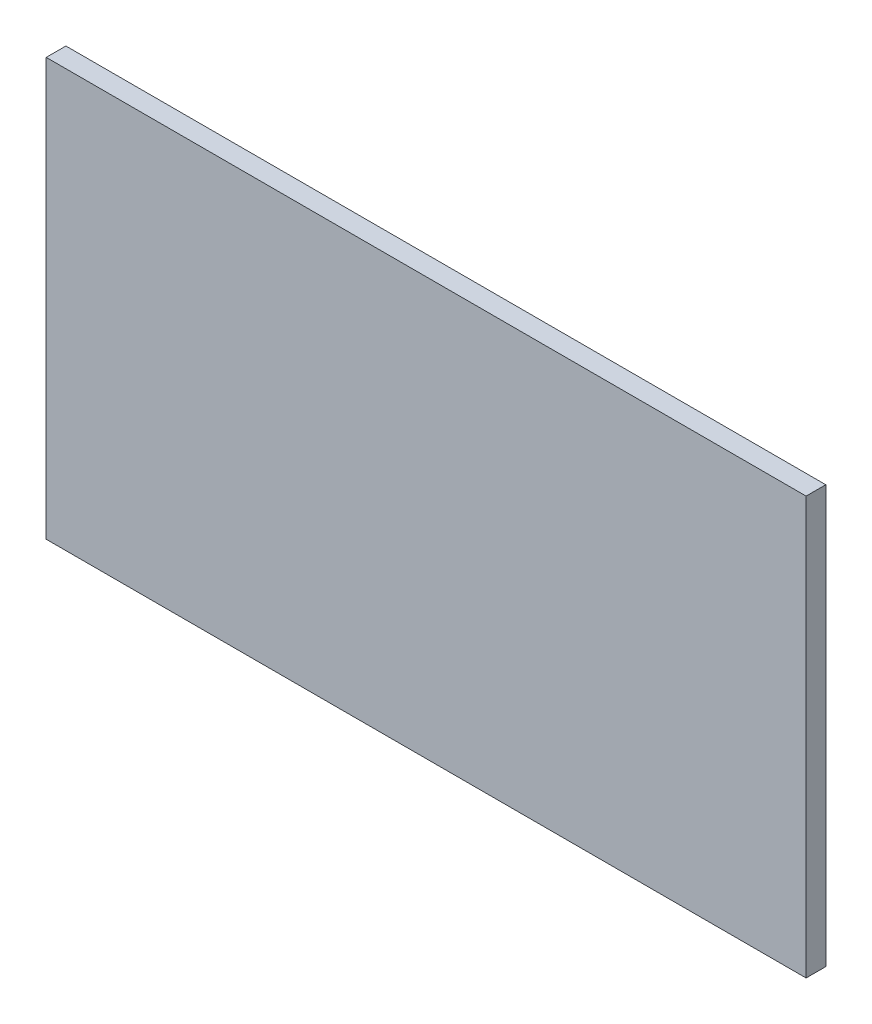
from build123d import *

# Parameters (mm, degrees)
ESQUISSE1_W        = 579
ESQUISSE1_H        = 318
BOSS_EXTRU_1_DEPTH = 15


with BuildPart() as part:
    # Esquisse1 → Boss.-Extru.1 (new body)
    with BuildSketch(Plane.XY):
        with Locations((289.5, 159)):
            Rectangle(ESQUISSE1_W, ESQUISSE1_H)
    extrude(amount=BOSS_EXTRU_1_DEPTH)


solid = part.part
